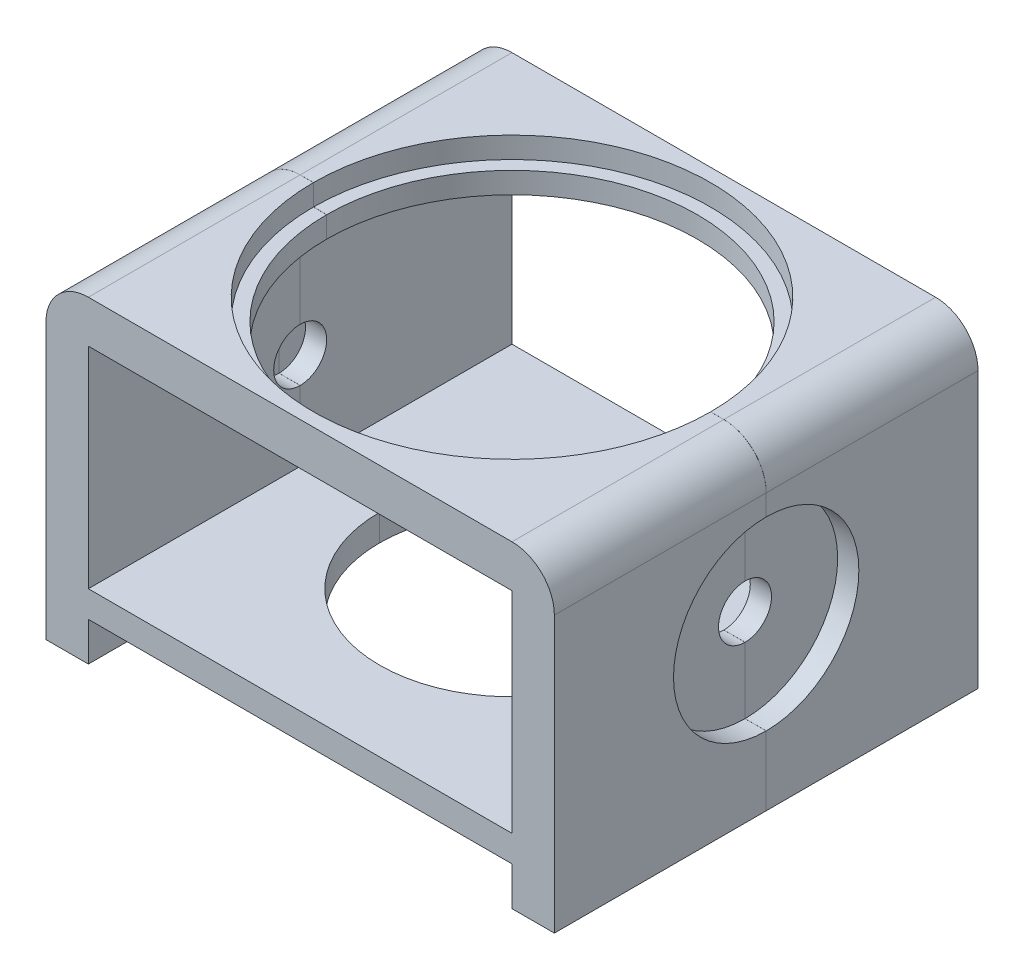
from build123d import *

# Parameters (mm, degrees)
SKETCH2_W           = 80
SKETCH2_H           = 39.677071002
BOSS_EXTRUDE1_DEPTH = 80
SKETCH3_R           = 37.5
CUT_EXTRUDE1_DEPTH  = 4
SKETCH4_R           = 35
CUT_EXTRUDE2_DEPTH  = 4
SKETCH5_R           = 25
CUT_EXTRUDE3_DEPTH  = 134.750151773
SKETCH6_W           = 12
SKETCH6_H           = 30
CUT_EXTRUDE4_DEPTH  = 134.750151773
SKETCH7_R           = 5
CUT_EXTRUDE5_DEPTH  = 92
SKETCH8_R           = 17.5
CUT_EXTRUDE6_DEPTH  = 4
SKETCH9_W           = 153.346772702
SKETCH9_H           = 84.356288718
CUT_EXTRUDE8_DEPTH  = 0.01


with BuildPart() as part:
    # Sketch2 → Boss-Extrude1 (new body)
    with BuildSketch(Plane.XY):
        with BuildLine():
            Line((0, 0), (0, 52))
            ThreePointArc((0, 52), (-2.343145751, 57.656854249), (-8, 60))
            Line((-8, 60), (-88, 60))
            ThreePointArc((-88, 60), (-93.656854249, 57.656854249), (-96, 52))
            Line((-96, 52), (-96, 0))
            Line((-96, 0), (-88, 0))
            Line((-88, 0), (-88, 7.322928998))
            Line((-88, 7.322928998), (-8, 7.322928998))
            Line((-8, 7.322928998), (-8, 0))
            Line((-8, 0), (0, 0))
        make_face()
        with Locations((-48, 32.161464499)):
            Rectangle(SKETCH2_W, SKETCH2_H, mode=Mode.SUBTRACT)
    extrude(amount=BOSS_EXTRUDE1_DEPTH)

    # Sketch3 → Cut-Extrude1 (cut)
    with BuildSketch(Plane(origin=(0, 60, 0), x_dir=(1, 0, 0), z_dir=(0, 1, 0))):
        with Locations(Location((-48, -40, 0), (0, 0, 180))):
            Circle(SKETCH3_R)
    extrude(amount=-CUT_EXTRUDE1_DEPTH, mode=Mode.SUBTRACT)

    # Sketch4 → Cut-Extrude2 (cut)
    with BuildSketch(Plane(origin=(0, 56, 0), x_dir=(1, 0, 0), z_dir=(0, 1, 0))):
        with Locations(Location((-48, -40, 0), (0, 0, 180))):
            Circle(SKETCH4_R)
    extrude(amount=-CUT_EXTRUDE2_DEPTH, mode=Mode.SUBTRACT)

    # Sketch5 → Cut-Extrude3 (cut, through all)
    with BuildSketch(Plane(origin=(0, 12.322928998, 0), x_dir=(1, 0, 0), z_dir=(0, 1, 0))):
        with Locations(Location((-48, -40, 0), (0, 0, 180))):
            Circle(SKETCH5_R)
    extrude(amount=-CUT_EXTRUDE3_DEPTH, mode=Mode.SUBTRACT)

    # Sketch6 → Cut-Extrude4 (cut, through all)
    with BuildSketch(Plane(origin=(0, 12.322928998, 0), x_dir=(1, 0, 0), z_dir=(0, 1, 0))):
        with Locations((-14, -40)):
            Rectangle(SKETCH6_W, SKETCH6_H)
    extrude(amount=-CUT_EXTRUDE4_DEPTH, mode=Mode.SUBTRACT)

    # Sketch7 → Cut-Extrude5 (cut)
    with BuildSketch(Plane(origin=(0, 0, 0), x_dir=(0, 0, -1), z_dir=(1, 0, 0))):
        with Locations((-40, 30.57)):
            Circle(SKETCH7_R)
    extrude(amount=-CUT_EXTRUDE5_DEPTH, mode=Mode.SUBTRACT)

    # Sketch8 → Cut-Extrude6 (cut)
    with BuildSketch(Plane(origin=(0, 0, 0), x_dir=(0, 0, -1), z_dir=(1, 0, 0))):
        with Locations((-40, 30.57)):
            Circle(SKETCH8_R)
    extrude(amount=-CUT_EXTRUDE6_DEPTH, mode=Mode.SUBTRACT)

    # Sketch9 → Cut-Extrude8 (cut)
    with BuildSketch(Plane.XY.offset(40)):
        with Locations((-44.909168978, 22.501506988)):
            Rectangle(SKETCH9_W, SKETCH9_H)
    extrude(amount=-CUT_EXTRUDE8_DEPTH, mode=Mode.SUBTRACT)


with BuildPart() as cut_extrude8_piece_1:
    # of the separate pieces the step leaves, piece 1, a body of its own (cut_extrude8_pieces)
    add(part.part.solids().sort_by_distance((0, 13.07, 40))[0])


with BuildPart() as cut_extrude8_piece_2:
    # of the separate pieces the step leaves, piece 2, a body of its own (cut_extrude8_pieces)
    add(part.part.solids().sort_by_distance((0, 0, 0))[0])


solid = Compound([cut_extrude8_piece_1.part, cut_extrude8_piece_2.part])
